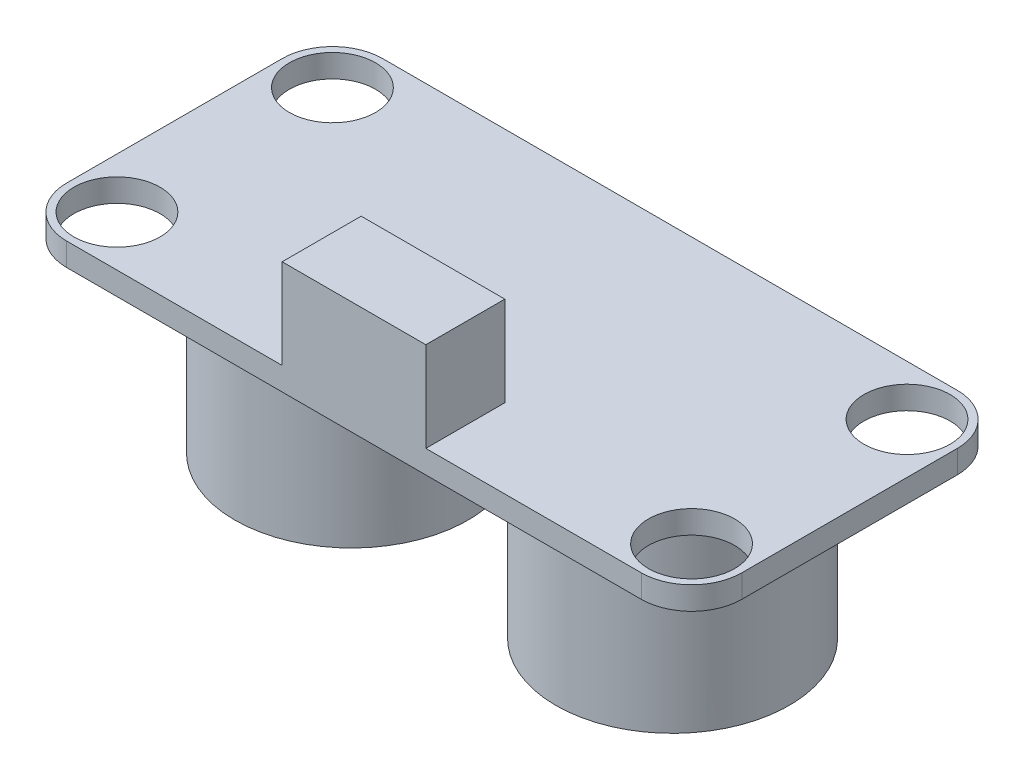
from build123d import *

# Parameters (mm, degrees)
SKETCH1_R           = 3
BOSS_EXTRUDE1_DEPTH = 1.6
SKETCH2_W           = 10
SKETCH2_H           = 5.5
BOSS_EXTRUDE2_DEPTH = 6.25
SKETCH3_R           = 8.125
BOSS_EXTRUDE3_DEPTH = 12.25


with BuildPart() as part:
    # Sketch1 → Boss-Extrude1 (new body)
    with BuildSketch(Plane(origin=(0, 0, 0), x_dir=(1, 0, 0), z_dir=(0, 1, 0))):
        with BuildLine():
            Line((3.5, 0), (43.5, 0))
            ThreePointArc((43.5, 0), (45.974873734, 1.025126266), (47, 3.5))
            Line((47, 3.5), (47, 18.5))
            ThreePointArc((47, 18.5), (45.974873734, 20.974873734), (43.5, 22))
            Line((43.5, 22), (3.5, 22))
            ThreePointArc((3.5, 22), (1.025126266, 20.974873734), (0, 18.5))
            Line((0, 18.5), (0, 3.5))
            ThreePointArc((0, 3.5), (1.025126266, 1.025126266), (3.5, 0))
        make_face()
        with Locations(Location((3.5, 18.5, 0), (0, 0, 270))):
            Circle(SKETCH1_R, mode=Mode.SUBTRACT)
        with Locations(Location((3.5, 3.5, 0), (0, 0, 270))):
            Circle(SKETCH1_R, mode=Mode.SUBTRACT)
        with Locations(Location((43.5, 3.5, 0), (0, 0, 270))):
            Circle(SKETCH1_R, mode=Mode.SUBTRACT)
        with Locations(Location((43.5, 18.5, 0), (0, 0, 270))):
            Circle(SKETCH1_R, mode=Mode.SUBTRACT)
    extrude(amount=BOSS_EXTRUDE1_DEPTH)

    # Sketch2 → Boss-Extrude2 (add)
    with BuildSketch(Plane(origin=(0, 1.6, 0), x_dir=(1, 0, 0), z_dir=(0, 1, 0))):
        with Locations((23.5, 2.75)):
            Rectangle(SKETCH2_W, SKETCH2_H)
    extrude(amount=BOSS_EXTRUDE2_DEPTH)

    # Sketch3 → Boss-Extrude3 (add)
    with BuildSketch(Plane(origin=(0, 0, 0), x_dir=(-1, 0, 0), z_dir=(0, -1, 0))):
        with Locations(Location((-12.325, 11, 0), (0, 0, 270))):
            Circle(SKETCH3_R)
        with Locations(Location((-34.675, 11, 0), (0, 0, 270))):
            Circle(SKETCH3_R)
    extrude(amount=BOSS_EXTRUDE3_DEPTH)


solid = part.part
